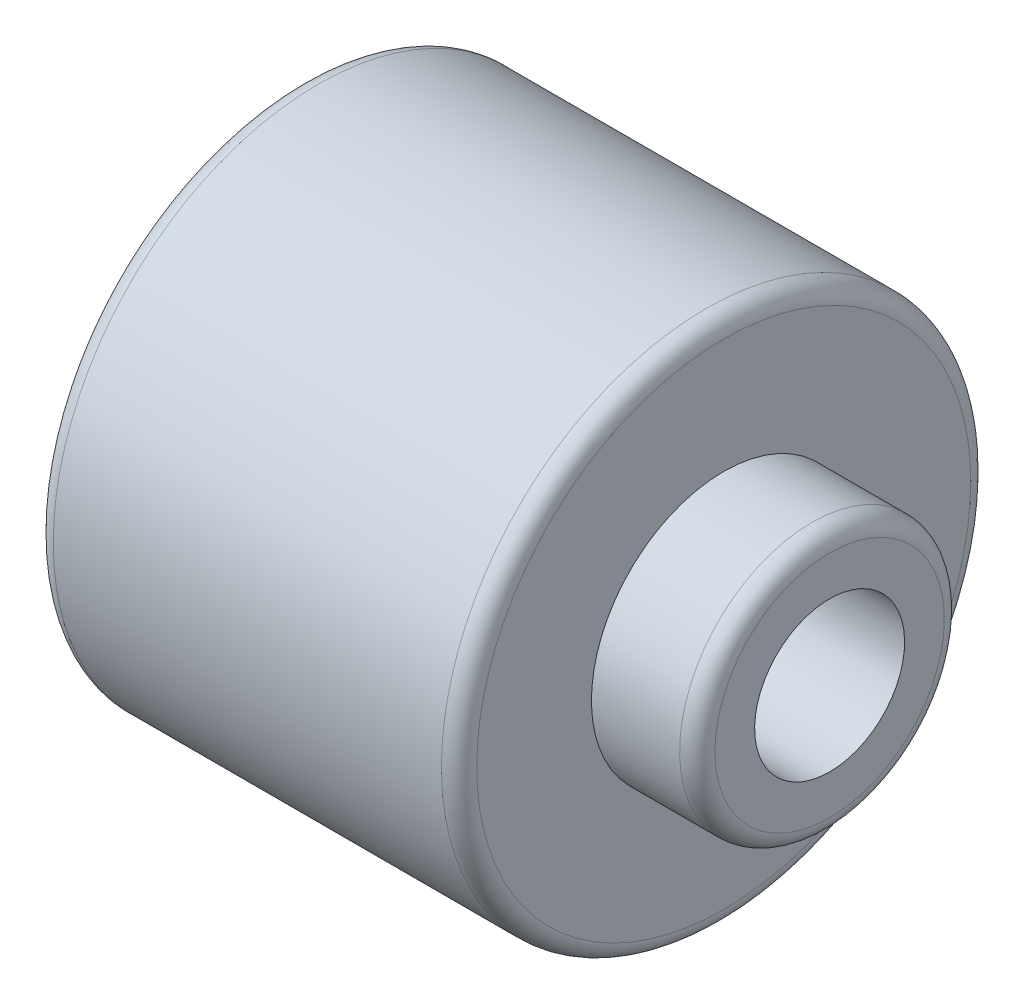
from build123d import *

# Parameters (mm, degrees)
IZIM2_R               = 4.25
KES_EKSTR_ZYON1_DEPTH = 30
RADYUS1_R             = 1


with BuildPart() as part:
    # Çizim1 → Döndür1 (revolve)
    with BuildSketch(Plane.XY):
        Polygon((0, 0), (0, 15), (24, 15), (24, 7.5), (30, 7.5), (30, 0), align=None)
    revolve(axis=Axis((30, 0, 0), (-1, 0, 0)))

    # Çizim2 → Kes-Ekstrüzyon1 (cut)
    with BuildSketch(Plane.ZY):
        with Locations(Location((0, 0, 0), (0, 0, 270))):
            Circle(IZIM2_R)
    extrude(amount=-KES_EKSTR_ZYON1_DEPTH, mode=Mode.SUBTRACT)

    # Radyus1
    radyus1_edges = [part.edges().sort_by_distance(p)[0] for p in [
        (30, -7.5, 0),
        (24, -15, 0),
        (0, -15, 0),
    ]]
    fillet(radyus1_edges, radius=RADYUS1_R)


solid = part.part
